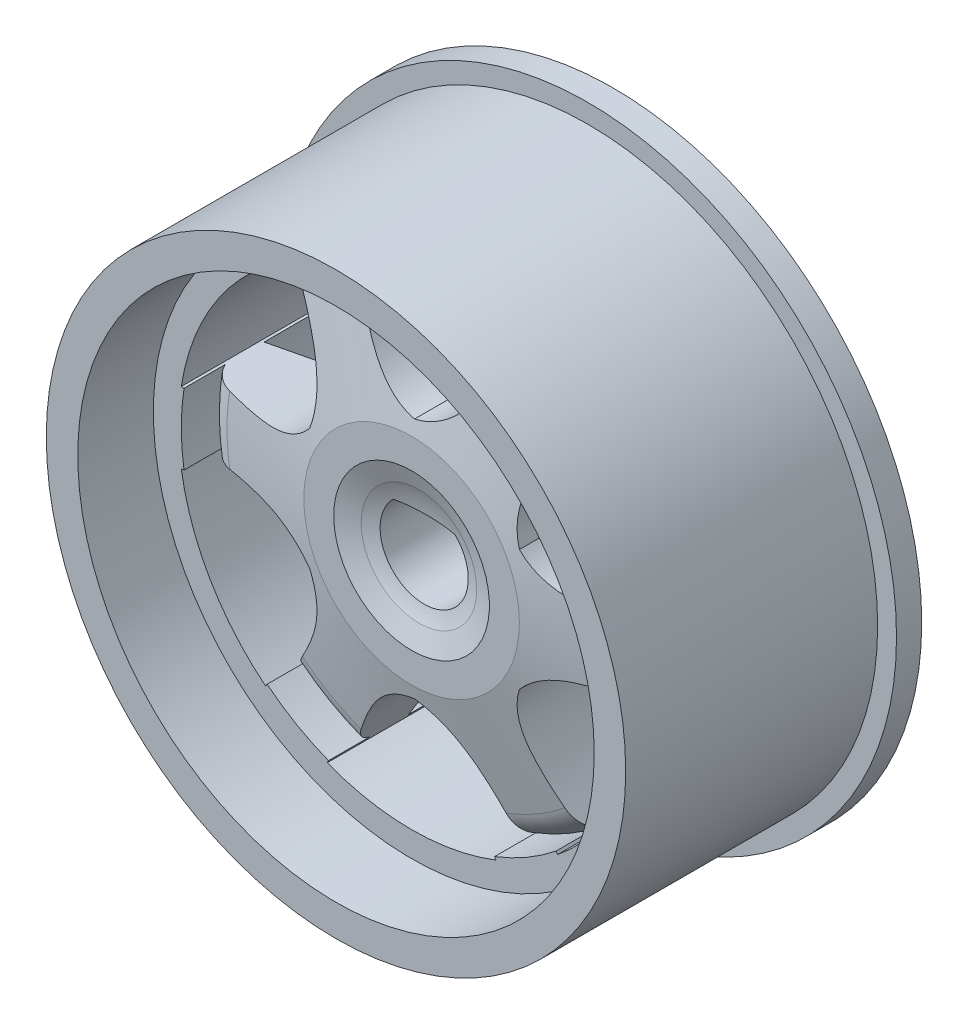
from build123d import *

# Parameters (mm, degrees)
SKETCH_1_R          = 11.5
SKETCH_1_R_2        = 10.25
EXTRUDE_1_DEPTH     = 11
SKETCH_1_3_R        = 12.25
SKETCH_1_3_R_2      = 11.5
EXTRUDE_2_DEPTH     = 1
SKETCH_1_4_R        = 10.25
EXTRUDE_3_DEPTH     = 8
CUT_EXTRUDE_1_REACH = 22.521


with BuildPart() as part:
    # 草图1 → 凸台-拉伸1 (new body)
    with BuildSketch(Plane.XY):
        Circle(SKETCH_1_R)
        Circle(SKETCH_1_R_2, mode=Mode.SUBTRACT)
    extrude(amount=EXTRUDE_1_DEPTH)

    # 草图1<3> → 凸台-拉伸2 (add)
    with BuildSketch(Plane.XY):
        Circle(SKETCH_1_3_R)
        Circle(SKETCH_1_3_R_2, mode=Mode.SUBTRACT)
    extrude(amount=EXTRUDE_2_DEPTH)

    # 草图1<4> → 凸台-拉伸3 (add)
    with BuildSketch(Plane.XY):
        Circle(SKETCH_1_4_R)
        with BuildLine():
            add(Edge.make_bspline(
                [(3.346762755, 8.623321811), (2.607086427, 7.172306043), (1.848981156, 5.141959541), (0, 4.808175874)],
                knots=[0, 0, 0, 0, 1, 1, 1, 1], degree=3))
            add(Edge.make_bspline(
                [(-3.346762755, 8.623321811), (-2.607086427, 7.172306043), (-1.848981156, 5.141959541), (0, 4.808175874)],
                knots=[0, 0, 0, 0, 1, 1, 1, 1], degree=3))
            ThreePointArc((-3.346762755, 8.623321811), (0, 9.25), (3.346762755, 8.623321811))
        make_face(mode=Mode.SUBTRACT)
        with BuildLine():
            add(Edge.make_bspline(
                [(5.794634376, 7.210042472), (4.907856023, 5.843956097), (3.52857701, 4.172244422), (4.164002453, 2.404087937)],
                knots=[0, 0, 0, 0, 1, 1, 1, 1], degree=3))
            ThreePointArc((5.794634376, 7.210042472), (8.010734985, 4.625), (9.141397131, 1.41327934))
            add(Edge.make_bspline(
                [(9.141397131, 1.41327934), (7.51494245, 1.328349946), (5.377558165, 0.969715119), (4.164002453, 2.404087937)],
                knots=[0, 0, 0, 0, 1, 1, 1, 1], degree=3))
        make_face(mode=Mode.SUBTRACT)
        with BuildLine():
            add(Edge.make_bspline(
                [(9.141397131, -1.41327934), (7.51494245, -1.328349946), (5.377558165, -0.969715119), (4.164002453, -2.404087937)],
                knots=[0, 0, 0, 0, 1, 1, 1, 1], degree=3))
            ThreePointArc((9.141397131, -1.41327934), (8.010734985, -4.625), (5.794634376, -7.210042472))
            add(Edge.make_bspline(
                [(5.794634376, -7.210042472), (4.907856023, -5.843956097), (3.52857701, -4.172244422), (4.164002453, -2.404087937)],
                knots=[0, 0, 0, 0, 1, 1, 1, 1], degree=3))
        make_face(mode=Mode.SUBTRACT)
        with BuildLine():
            add(Edge.make_bspline(
                [(3.346762755, -8.623321811), (2.607086427, -7.172306043), (1.848981156, -5.141959541), (0, -4.808175874)],
                knots=[0, 0, 0, 0, 1, 1, 1, 1], degree=3))
            ThreePointArc((3.346762755, -8.623321811), (0, -9.25), (-3.346762755, -8.623321811))
            add(Edge.make_bspline(
                [(-3.346762755, -8.623321811), (-2.607086427, -7.172306043), (-1.848981156, -5.141959541), (0, -4.808175874)],
                knots=[0, 0, 0, 0, 1, 1, 1, 1], degree=3))
        make_face(mode=Mode.SUBTRACT)
        with BuildLine():
            add(Edge.make_bspline(
                [(-5.794634376, -7.210042472), (-4.907856023, -5.843956097), (-3.52857701, -4.172244422), (-4.164002453, -2.404087937)],
                knots=[0, 0, 0, 0, 1, 1, 1, 1], degree=3))
            ThreePointArc((-5.794634376, -7.210042472), (-8.010734985, -4.625), (-9.141397131, -1.41327934))
            add(Edge.make_bspline(
                [(-9.141397131, -1.41327934), (-7.51494245, -1.328349946), (-5.377558165, -0.969715119), (-4.164002453, -2.404087937)],
                knots=[0, 0, 0, 0, 1, 1, 1, 1], degree=3))
        make_face(mode=Mode.SUBTRACT)
        with BuildLine():
            add(Edge.make_bspline(
                [(-9.141397131, 1.41327934), (-7.51494245, 1.328349946), (-5.377558165, 0.969715119), (-4.164002453, 2.404087937)],
                knots=[0, 0, 0, 0, 1, 1, 1, 1], degree=3))
            ThreePointArc((-9.141397131, 1.41327934), (-8.010734985, 4.625), (-5.794634376, 7.210042472))
            add(Edge.make_bspline(
                [(-5.794634376, 7.210042472), (-4.907856023, 5.843956097), (-3.52857701, 4.172244422), (-4.164002453, 2.404087937)],
                knots=[0, 0, 0, 0, 1, 1, 1, 1], degree=3))
        make_face(mode=Mode.SUBTRACT)
    extrude(amount=EXTRUDE_3_DEPTH)

    # 草图2 → 切除-旋转2 (revolve, cut)
    with BuildSketch(Plane(origin=(0, 0, 0), x_dir=(1, 0, 0), z_dir=(0, 1, 0))):
        with BuildLine():
            Line((8.201182638, -7.125643519), (4.27938124, -8))
            Line((4.27938124, -8), (9.141397131, -8))
            Line((9.141397131, -8), (9.141397131, -6.363929473))
            ThreePointArc((9.141397131, -6.363929473), (8.760774177, -6.855240582), (8.201182638, -7.125643519))
        make_face()
        with BuildLine():
            Line((0.616343645, -7.332845775), (0, -7.332845775))
            Line((0, -7.332845775), (0, -8))
            Line((0, -8), (3.089773402, -8))
            Line((3.089773402, -8), (2.294742408, -7.708277077))
            ThreePointArc((2.294742408, -7.708277077), (1.476281298, -7.427849152), (0.616343645, -7.332845775))
        make_face()
        with BuildLine():
            Line((9.141397131, -4.82328712), (9.141397131, 0))
            Line((9.141397131, 0), (3.572906709, 0))
            ThreePointArc((3.572906709, 0), (5.035085187, -2.707168335), (7.637741172, -4.348176598))
            Line((7.637741172, -4.348176598), (9.141397131, -4.82328712))
        make_face()
    revolve(axis=Axis((0, 0, -3.218092852), (0, 0, 1)), mode=Mode.SUBTRACT)

    # 草图3 → 切除-拉伸1 (cut, up to next)
    with BuildSketch(Plane(origin=(0, 0, 0), x_dir=(-1, 0, 0), z_dir=(0, 0, -1)), mode=Mode.PRIVATE) as cut_extrude_1_sk1:
        with BuildLine():
            Line((-1.224744871, 1.25), (1.224744871, 1.25))
            ThreePointArc((1.224744871, 1.25), (0, -1.75), (-1.224744871, 1.25))
        make_face()
    cut_extrude_1_tool1 = extrude(cut_extrude_1_sk1.sketch, amount=-CUT_EXTRUDE_1_REACH, mode=Mode.PRIVATE) & part.part
    add(cut_extrude_1_tool1.solids().sort_by_distance((0, -0.139524, 0))[0], mode=Mode.SUBTRACT)


solid = part.part
